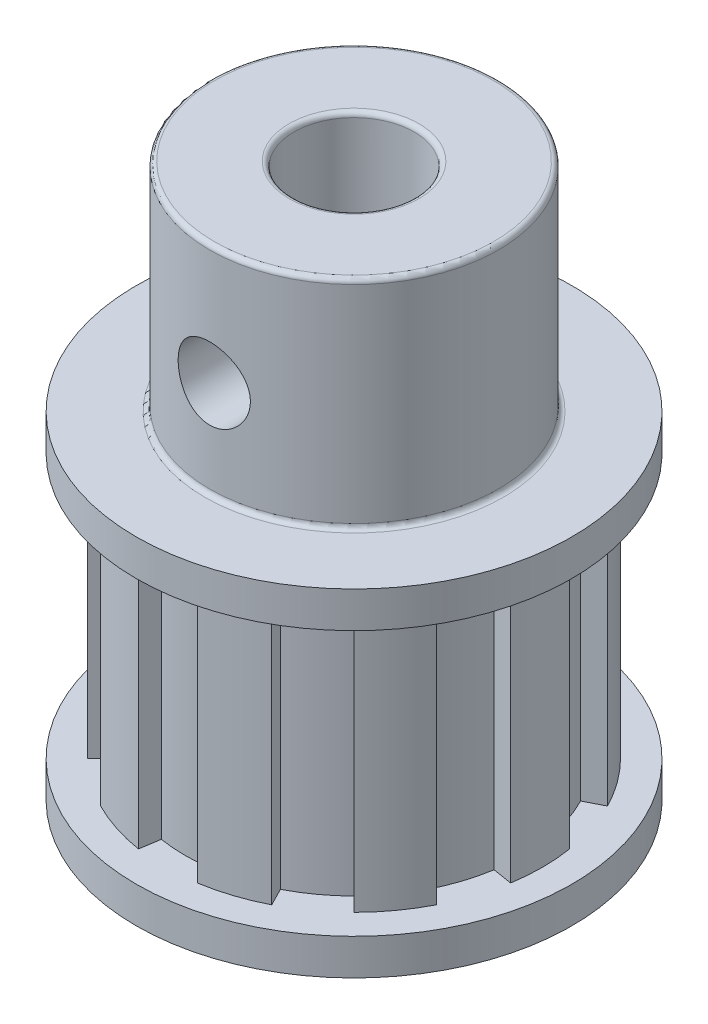
from build123d import *

# Parameters (mm, degrees)
SKETCH1_R               = 9.05
BOSS_EXTRUDE1_DEPTH     = 1.5
SKETCH2_R               = 7.83
BOSS_EXTRUDE2_DEPTH     = 11
CUT_EXTRUDE1_START      = -11
CUT_EXTRUDE1_DEPTH      = 11
SKETCH3_R               = 9.05
BOSS_EXTRUDE3_DEPTH     = 1.5
SKETCH5_R               = 6
BOSS_EXTRUDE4_DEPTH     = 9
SKETCH6_R               = 2.5
CUT_EXTRUDE2_DEPTH      = 27.321189183
CUT_EXTRUDE3_DEPTH      = 27.321189183
CUT_EXTRUDE3_DEPTH_BACK = 27.321189183
SKETCH7_R               = 1.5
FILLET1_R               = 0.2


with BuildPart() as part:
    # Sketch1 → Boss-Extrude1 (new body)
    with BuildSketch(Plane(origin=(0, 0, 0), x_dir=(1, 0, 0), z_dir=(0, 1, 0))):
        with Locations(Location((0, 0, 0), (0, 0, 270))):
            Circle(SKETCH1_R)
    extrude(amount=BOSS_EXTRUDE1_DEPTH)

    # Sketch2 → Boss-Extrude2 (add)
    with BuildSketch(Plane(origin=(0, 1.5, 0), x_dir=(1, 0, 0), z_dir=(0, 1, 0))):
        with Locations(Location((0, 0, 0), (0, 0, 270))):
            Circle(SKETCH2_R)
    extrude(amount=BOSS_EXTRUDE2_DEPTH)

    # Sketch4 → Cut-Extrude1 (cut)
    with BuildSketch(Plane(origin=(0, 12.5, 0), x_dir=(1, 0, 0), z_dir=(0, 1, 0)).offset(CUT_EXTRUDE1_START)):
        with BuildLine():
            Line((-1.095041255, 6.913818384), (-1.224881861, 7.733599707))
            ThreePointArc((-1.224881861, 7.733599707), (0, 7.83), (1.224881861, 7.733599707))
            Line((1.224881861, 7.733599707), (1.095041255, 6.913818384))
            ThreePointArc((1.095041255, 6.913818384), (0, 7), (-1.095041255, 6.913818384))
        make_face()
        with BuildLine():
            Line((3.177933498, 6.237045669), (3.554745613, 6.976581084))
            ThreePointArc((3.554745613, 6.976581084), (4.602358525, 6.334603066), (5.536646097, 5.536646097))
            Line((5.536646097, 5.536646097), (4.949747468, 4.949747468))
            ThreePointArc((4.949747468, 4.949747468), (4.114496766, 5.663118961), (3.177933498, 6.237045669))
        make_face()
        with BuildLine():
            Line((6.237045669, 3.177933498), (6.976581084, 3.554745613))
            ThreePointArc((6.976581084, 3.554745613), (7.446772523, 2.419603066), (7.733599707, 1.224881861))
            Line((7.733599707, 1.224881861), (6.913818384, 1.095041255))
            ThreePointArc((6.913818384, 1.095041255), (6.657395614, 2.163118961), (6.237045669, 3.177933498))
        make_face()
        with BuildLine():
            Line((6.913818384, -1.095041255), (7.733599707, -1.224881861))
            ThreePointArc((7.733599707, -1.224881861), (7.446772523, -2.419603066), (6.976581084, -3.554745613))
            Line((6.976581084, -3.554745613), (6.237045669, -3.177933498))
            ThreePointArc((6.237045669, -3.177933498), (6.657395614, -2.163118961), (6.913818384, -1.095041255))
        make_face()
        with BuildLine():
            Line((4.949747468, -4.949747468), (5.536646097, -5.536646097))
            ThreePointArc((5.536646097, -5.536646097), (4.602358525, -6.334603066), (3.554745613, -6.976581084))
            Line((3.554745613, -6.976581084), (3.177933498, -6.237045669))
            ThreePointArc((3.177933498, -6.237045669), (4.114496766, -5.663118961), (4.949747468, -4.949747468))
        make_face()
        with BuildLine():
            Line((1.095041255, -6.913818384), (1.224881861, -7.733599707))
            ThreePointArc((1.224881861, -7.733599707), (0, -7.83), (-1.224881861, -7.733599707))
            Line((-1.224881861, -7.733599707), (-1.095041255, -6.913818384))
            ThreePointArc((-1.095041255, -6.913818384), (0, -7), (1.095041255, -6.913818384))
        make_face()
        with BuildLine():
            Line((-3.177933498, -6.237045669), (-3.554745613, -6.976581084))
            ThreePointArc((-3.554745613, -6.976581084), (-4.602358525, -6.334603066), (-5.536646097, -5.536646097))
            Line((-5.536646097, -5.536646097), (-4.949747468, -4.949747468))
            ThreePointArc((-4.949747468, -4.949747468), (-4.114496766, -5.663118961), (-3.177933498, -6.237045669))
        make_face()
        with BuildLine():
            Line((-6.237045669, -3.177933498), (-6.976581084, -3.554745613))
            ThreePointArc((-6.976581084, -3.554745613), (-7.446772523, -2.419603066), (-7.733599707, -1.224881861))
            Line((-7.733599707, -1.224881861), (-6.913818384, -1.095041255))
            ThreePointArc((-6.913818384, -1.095041255), (-6.657395614, -2.163118961), (-6.237045669, -3.177933498))
        make_face()
        with BuildLine():
            Line((-6.913818384, 1.095041255), (-7.733599707, 1.224881861))
            ThreePointArc((-7.733599707, 1.224881861), (-7.446772523, 2.419603066), (-6.976581084, 3.554745613))
            Line((-6.976581084, 3.554745613), (-6.237045669, 3.177933498))
            ThreePointArc((-6.237045669, 3.177933498), (-6.657395614, 2.163118961), (-6.913818384, 1.095041255))
        make_face()
        with BuildLine():
            Line((-4.949747468, 4.949747468), (-5.536646097, 5.536646097))
            ThreePointArc((-5.536646097, 5.536646097), (-4.602358525, 6.334603066), (-3.554745613, 6.976581084))
            Line((-3.554745613, 6.976581084), (-3.177933498, 6.237045669))
            ThreePointArc((-3.177933498, 6.237045669), (-4.114496766, 5.663118961), (-4.949747468, 4.949747468))
        make_face()
    extrude(amount=CUT_EXTRUDE1_DEPTH, mode=Mode.SUBTRACT)

    # Sketch3 → Boss-Extrude3 (add)
    with BuildSketch(Plane(origin=(0, 12.5, 0), x_dir=(1, 0, 0), z_dir=(0, 1, 0))):
        with Locations(Location((0, 0, 0), (0, 0, 270))):
            Circle(SKETCH3_R)
    extrude(amount=BOSS_EXTRUDE3_DEPTH)

    # Sketch5 → Boss-Extrude4 (add)
    with BuildSketch(Plane(origin=(0, 14, 0), x_dir=(1, 0, 0), z_dir=(0, 1, 0))):
        with Locations(Location((0, 0, 0), (0, 0, 270))):
            Circle(SKETCH5_R)
    extrude(amount=BOSS_EXTRUDE4_DEPTH)

    # Sketch6 → Cut-Extrude2 (cut, through all)
    with BuildSketch(Plane(origin=(0, 23, 0), x_dir=(1, 0, 0), z_dir=(0, 1, 0))):
        with Locations(Location((0, 0, 0), (0, 0, 270))):
            Circle(SKETCH6_R)
    extrude(amount=-CUT_EXTRUDE2_DEPTH, mode=Mode.SUBTRACT)

    # Sketch7 → Cut-Extrude3 (cut, two sides: drawn at the far end of the back side and taken through both)
    with BuildSketch(Plane.XY.offset(-CUT_EXTRUDE3_DEPTH_BACK)):
        with Locations((0, 18)):
            Circle(SKETCH7_R)
    extrude(amount=CUT_EXTRUDE3_DEPTH + CUT_EXTRUDE3_DEPTH_BACK, mode=Mode.SUBTRACT)

    # Fillet1
    fillet1_edges = [part.edges().sort_by_distance(p)[0] for p in [
        (0, 14, -6),
        (0, 23, -6),
        (0, 0, -2.5),
        (0, 23, -2.5),
    ]]
    fillet(fillet1_edges, radius=FILLET1_R)


solid = part.part
